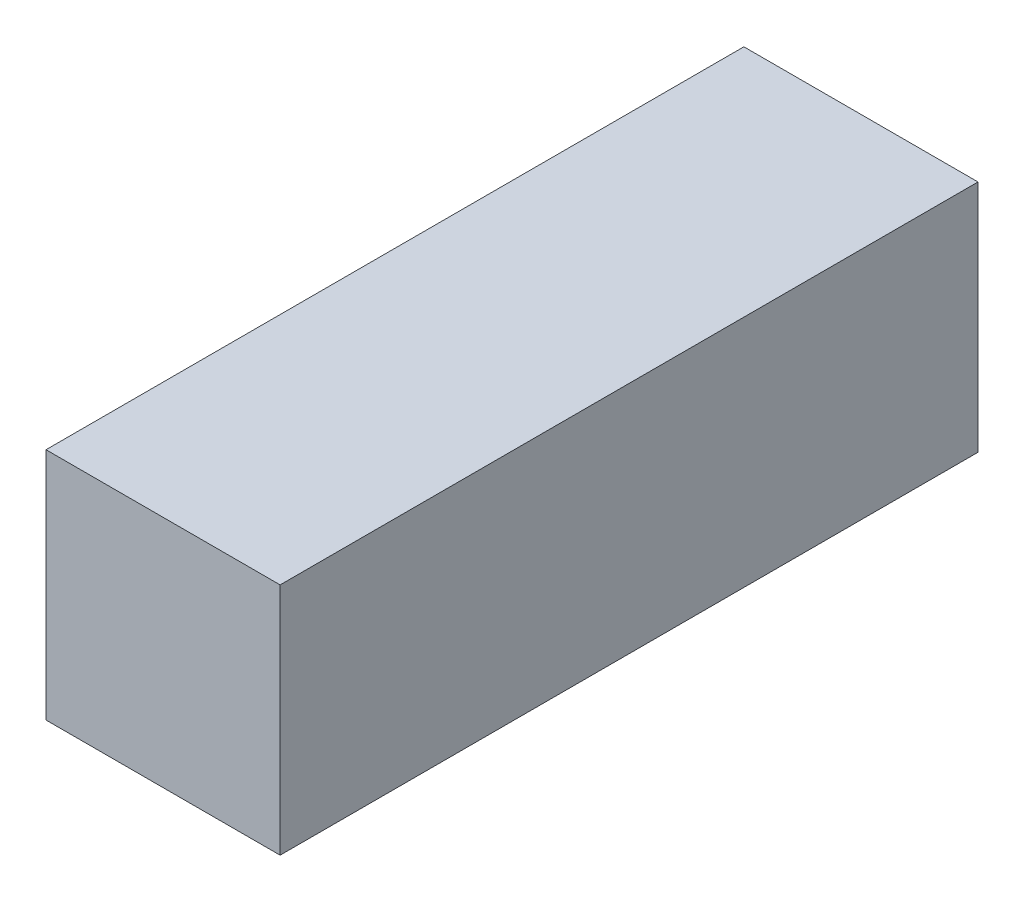
from build123d import *

# Parameters (mm, degrees)
SKETCH1_W           = 2667
SKETCH1_H           = 2667
SKETCH1_W_2         = 2590.8
SKETCH1_H_2         = 2590.8
BOSS_EXTRUDE1_DEPTH = 7924.8
SKETCH2_W           = 2667
SKETCH2_H           = 2667
BOSS_EXTRUDE2_DEPTH = 25.4


with BuildPart() as part:
    # Sketch1 → Boss-Extrude1 (new body)
    with BuildSketch(Plane.XY):
        with Locations((0, 1295.4)):
            Rectangle(SKETCH1_W, SKETCH1_H)
        with Locations((0, 1295.4)):
            Rectangle(SKETCH1_W_2, SKETCH1_H_2, mode=Mode.SUBTRACT)
    extrude(amount=BOSS_EXTRUDE1_DEPTH)

    # Sketch2 → Boss-Extrude2 (add)
    with BuildSketch(Plane.XY.offset(7924.8)):
        with Locations((0, 1295.4)):
            Rectangle(SKETCH2_W, SKETCH2_H)
    extrude(amount=BOSS_EXTRUDE2_DEPTH)


solid = part.part
